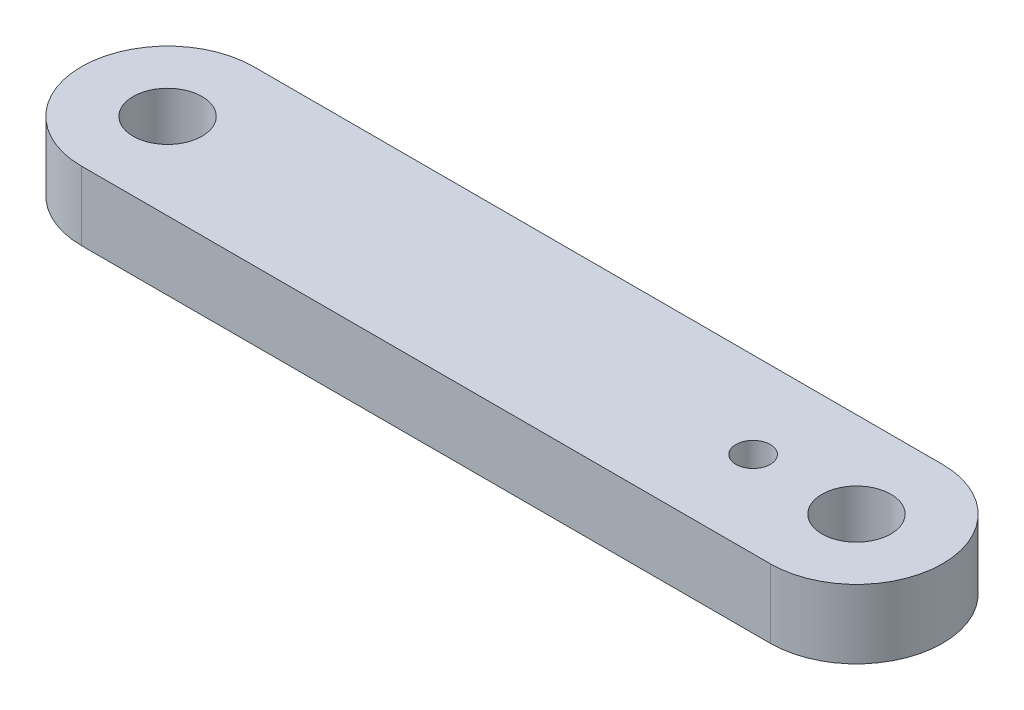
from build123d import *

# Parameters (mm, degrees)
SKETCH1_R           = 1
BOSS_EXTRUDE1_DEPTH = 2
SKETCH2_R           = 0.5
CUT_EXTRUDE1_DEPTH  = 10


with BuildPart() as part:
    # Sketch1 → Boss-Extrude1 (new body)
    with BuildSketch(Plane(origin=(0, 0, 0), x_dir=(1, 0, 0), z_dir=(0, 1, 0))):
        with BuildLine():
            Line((-10, 2.5), (10, 2.5))
            ThreePointArc((10, 2.5), (12.5, 0), (10, -2.5))
            Line((10, -2.5), (-10, -2.5))
            ThreePointArc((-10, -2.5), (-12.5, 0), (-10, 2.5))
        make_face()
        with Locations(Location((10, 0, 0), (0, 0, 270))):
            Circle(SKETCH1_R, mode=Mode.SUBTRACT)
        with Locations(Location((-10, 0, 0), (0, 0, 270))):
            Circle(SKETCH1_R, mode=Mode.SUBTRACT)
    extrude(amount=BOSS_EXTRUDE1_DEPTH)

    # Sketch2 → Cut-Extrude1 (cut)
    with BuildSketch(Plane(origin=(0, 2, 0), x_dir=(1, 0, 0), z_dir=(0, 1, 0))):
        with Locations(Location((7, 0, 0), (0, 0, 270))):
            Circle(SKETCH2_R)
    extrude(amount=-CUT_EXTRUDE1_DEPTH, mode=Mode.SUBTRACT)


solid = part.part
